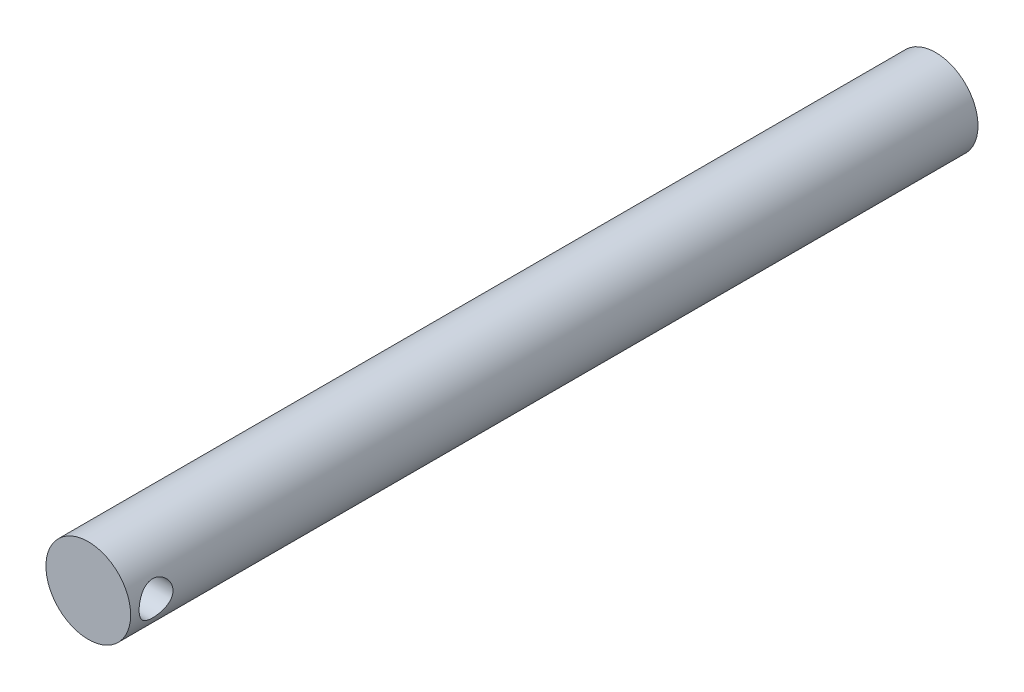
from build123d import *

# Parameters (mm, degrees)
SKETCH_1_R               = 2.5
EXTRUDE_1_DEPTH          = 50
CUT_EXTRUDE_1_DEPTH      = 51.124844139
CUT_EXTRUDE_1_DEPTH_BACK = 51.124844139
SKETCH_3_R               = 1


with BuildPart() as part:
    # 草图1 → 凸台-拉伸1 (new body)
    with BuildSketch(Plane.XY):
        Circle(SKETCH_1_R)
    extrude(amount=EXTRUDE_1_DEPTH)

    # 草图3 → 切除-拉伸1 (cut, two sides: drawn at the far end of the back side and taken through both)
    with BuildSketch(Plane(origin=(0, 0, 0), x_dir=(0, 0, -1), z_dir=(1, 0, 0)).offset(-CUT_EXTRUDE_1_DEPTH_BACK)):
        with Locations((-48.5, 0)):
            Circle(SKETCH_3_R)
    extrude(amount=CUT_EXTRUDE_1_DEPTH + CUT_EXTRUDE_1_DEPTH_BACK, mode=Mode.SUBTRACT)


solid = part.part
